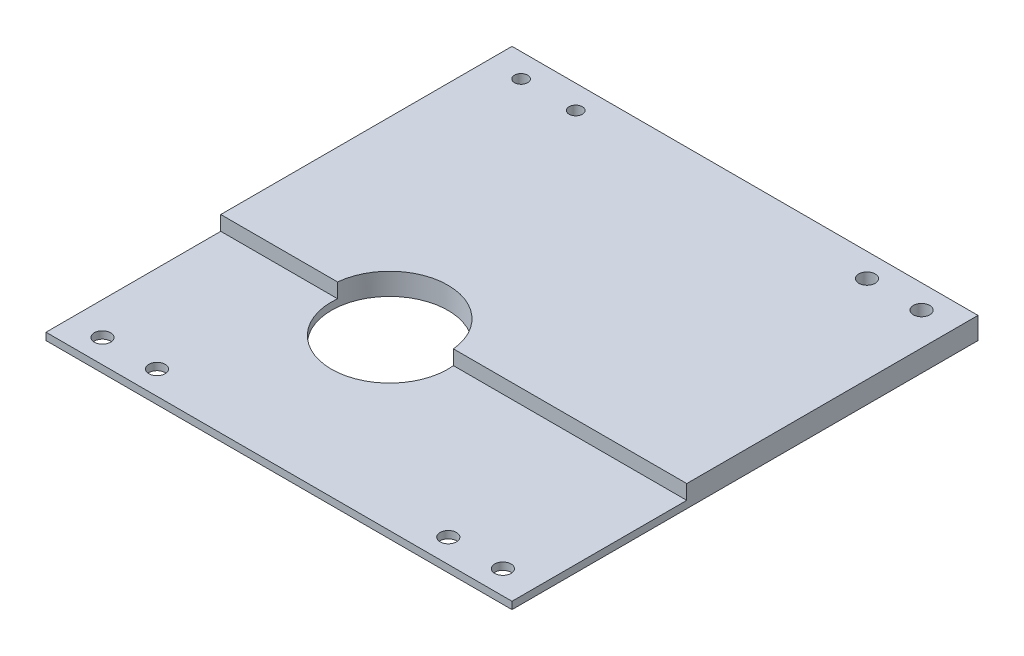
from build123d import *

# Parameters (mm, degrees)
SKETCH1_W               = 406.4
SKETCH1_H               = 406.4
BOSS_EXTRUDE1_DEPTH     = 6.35
SKETCH2_R               = 50.8
CUT_EXTRUDE1_DEPTH      = 6.35
SKETCH3_W               = 406.4
SKETCH3_H               = 254
BOSS_EXTRUDE4_DEPTH     = 12.7
SKETCH6_R               = 50.8
CUT_EXTRUDE3_DEPTH      = 288.998927949
SKETCH7_R               = 7.14375
CUT_EXTRUDE4_DEPTH      = 288.648691984
F_1_2_20_TAPPED_HOLE1_D = 11.50874
SKETCH11_R              = 7.14375
CUT_EXTRUDE5_DEPTH      = 288.998927949


with BuildPart() as part:
    # Sketch1 → Boss-Extrude1 (new body)
    with BuildSketch(Plane(origin=(0, 0, 0), x_dir=(1, 0, 0), z_dir=(0, 1, 0))):
        Rectangle(SKETCH1_W, SKETCH1_H)
    extrude(amount=BOSS_EXTRUDE1_DEPTH)

    # Sketch2 → Cut-Extrude1 (cut)
    with BuildSketch(Plane(origin=(0, 6.35, 0), x_dir=(1, 0, 0), z_dir=(0, 1, 0))):
        with Locations(Location((-50.8, -55.88, 0), (0, 0, 270))):
            Circle(SKETCH2_R)
    extrude(amount=-CUT_EXTRUDE1_DEPTH, mode=Mode.SUBTRACT)

    # Sketch3 → Boss-Extrude4 (add)
    with BuildSketch(Plane(origin=(0, 6.35, 0), x_dir=(1, 0, 0), z_dir=(0, 1, 0))):
        with Locations((0, 76.2)):
            Rectangle(SKETCH3_W, SKETCH3_H)
    extrude(amount=BOSS_EXTRUDE4_DEPTH)

    # Sketch6 → Cut-Extrude3 (cut, through all)
    with BuildSketch(Plane.XZ):
        with Locations(Location((-50.8, 55.88, 0), (0, 0, 90))):
            Circle(SKETCH6_R)
    extrude(amount=-CUT_EXTRUDE3_DEPTH, mode=Mode.SUBTRACT)

    # Sketch7 → Cut-Extrude4 (cut, through all)
    with BuildSketch(Plane(origin=(0, 6.35, 0), x_dir=(1, 0, 0), z_dir=(0, 1, 0))):
        with Locations(Location((174.625, -182.5625, 0), (0, 0, 270))):
            Circle(SKETCH7_R)
        with Locations(Location((127, -182.5625, 0), (0, 0, 270))):
            Circle(SKETCH7_R)
        with Locations(Location((-174.625, -182.5625, 0), (0, 0, 270))):
            Circle(SKETCH7_R)
        with Locations(Location((-127, -182.5625, 0), (0, 0, 270))):
            Circle(SKETCH7_R)
    extrude(amount=-CUT_EXTRUDE4_DEPTH, mode=Mode.SUBTRACT)

    # 1/2-20 Tapped Hole1 (through all)
    with Locations(Plane(origin=(0, 19.05, 0), x_dir=(1, 0, 0), z_dir=(0, 1, 0))):
        with Locations((-174.625, 182.5625), (-127, 182.5625)):
            Hole(F_1_2_20_TAPPED_HOLE1_D / 2)

    # Sketch11 → Cut-Extrude5 (cut, through all)
    with BuildSketch(Plane(origin=(0, 19.05, 0), x_dir=(1, 0, 0), z_dir=(0, 1, 0))):
        with Locations(Location((174.625, 182.5625, 0), (0, 0, 270))):
            Circle(SKETCH11_R)
        with Locations(Location((127, 182.5625, 0), (0, 0, 270))):
            Circle(SKETCH11_R)
    extrude(amount=-CUT_EXTRUDE5_DEPTH, mode=Mode.SUBTRACT)


solid = part.part
